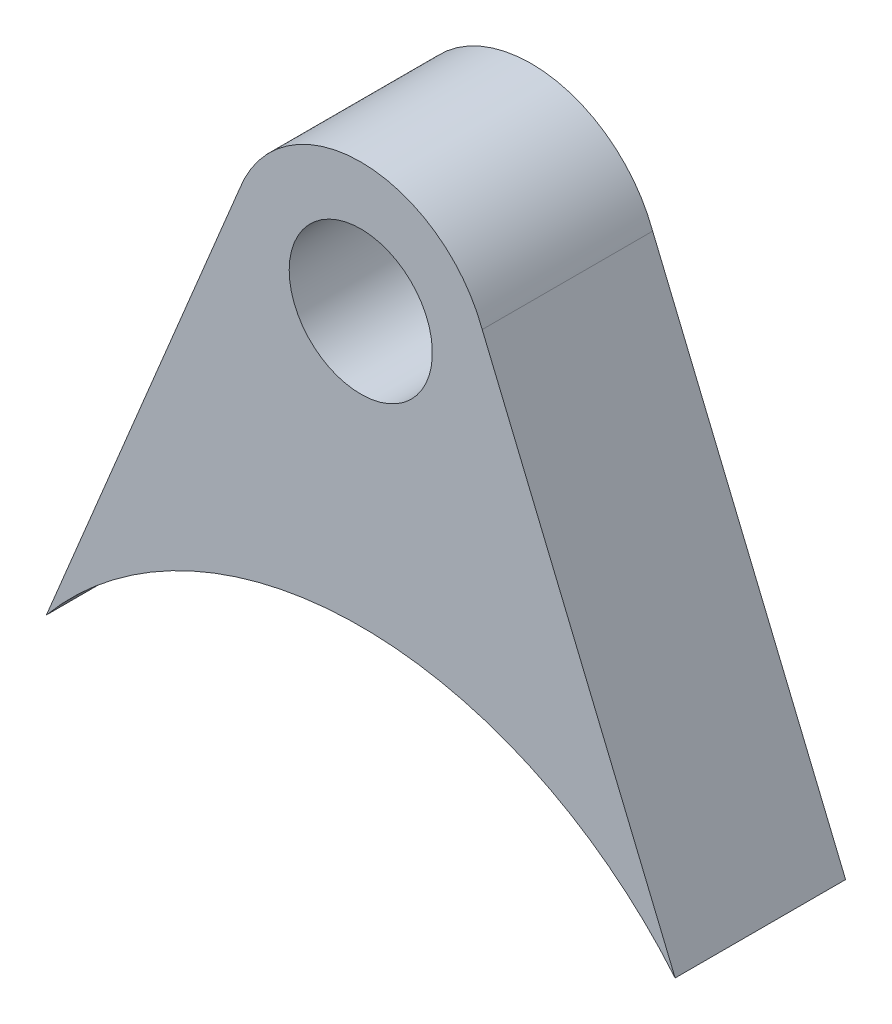
from build123d import *

# Parameters (mm, degrees)
DODANIE_WYCI_GNI_CIE1_START = -9.7
SZKIC2_R                    = 2.1
DODANIE_WYCI_GNI_CIE1_DEPTH = 5


with BuildPart() as part:
    # Szkic2 → Dodanie-wyciągnięcie1 (new body)
    with BuildSketch(Plane(origin=(0, 0, 16.9), x_dir=(-1, 0, 0), z_dir=(0, 0, -1)).offset(DODANIE_WYCI_GNI_CIE1_START)):
        with BuildLine():
            ThreePointArc((-9.222220763, 7.677932287), (0, 12), (9.222220763, 7.677932287))
            Line((9.222220763, 7.677932287), (3.562363692, 21.322711203))
            ThreePointArc((3.562363692, 21.322711203), (0, 23.8), (-3.562363692, 21.322711203))
            Line((-3.562363692, 21.322711203), (-9.222220763, 7.677932287))
        make_face()
        with Locations((0, 20)):
            Circle(SZKIC2_R, mode=Mode.SUBTRACT)
    extrude(amount=-DODANIE_WYCI_GNI_CIE1_DEPTH)


solid = part.part
